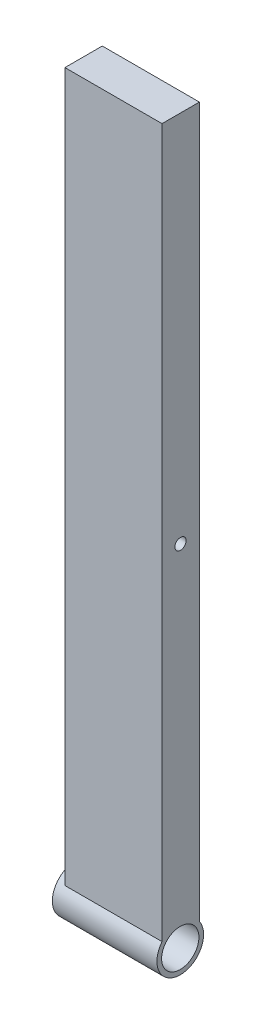
from build123d import *

# Parameters (mm, degrees)
SKETCH8_W           = 26
SKETCH8_H           = 10
BOSS_EXTRUDE5_DEPTH = 190
SKETCH9_R           = 6.25
BOSS_EXTRUDE7_DEPTH = 28
SKETCH13_R          = 5
CUT_EXTRUDE3_DEPTH  = 28
SKETCH14_R          = 1.5
CUT_EXTRUDE4_DEPTH  = 28


with BuildPart() as part:
    # Sketch8 → Boss-Extrude5 (new body)
    with BuildSketch(Plane(origin=(0, 0, 0), x_dir=(1, 0, 0), z_dir=(0, 1, 0))):
        Rectangle(SKETCH8_W, SKETCH8_H)
    extrude(amount=BOSS_EXTRUDE5_DEPTH)

    # Sketch9 → Boss-Extrude7 (add)
    with BuildSketch(Plane(origin=(13, 0, 0), x_dir=(0, 0, -1), z_dir=(1, 0, 0))):
        with Locations((-0.118358798, -3.586767795)):
            Circle(SKETCH9_R)
    extrude(amount=-BOSS_EXTRUDE7_DEPTH)

    # Sketch13 → Cut-Extrude3 (cut)
    with BuildSketch(Plane(origin=(13, 0, 0), x_dir=(0, 0, -1), z_dir=(1, 0, 0))):
        with Locations((-0.118358798, -3.586767795)):
            Circle(SKETCH13_R)
    extrude(amount=-CUT_EXTRUDE3_DEPTH, mode=Mode.SUBTRACT)

    # Sketch14 → Cut-Extrude4 (cut)
    with BuildSketch(Plane(origin=(13, 0, 0), x_dir=(0, 0, -1), z_dir=(1, 0, 0))):
        with Locations((-0.059179399, 90.081616102)):
            Circle(SKETCH14_R)
    extrude(amount=-CUT_EXTRUDE4_DEPTH, mode=Mode.SUBTRACT)


solid = part.part
